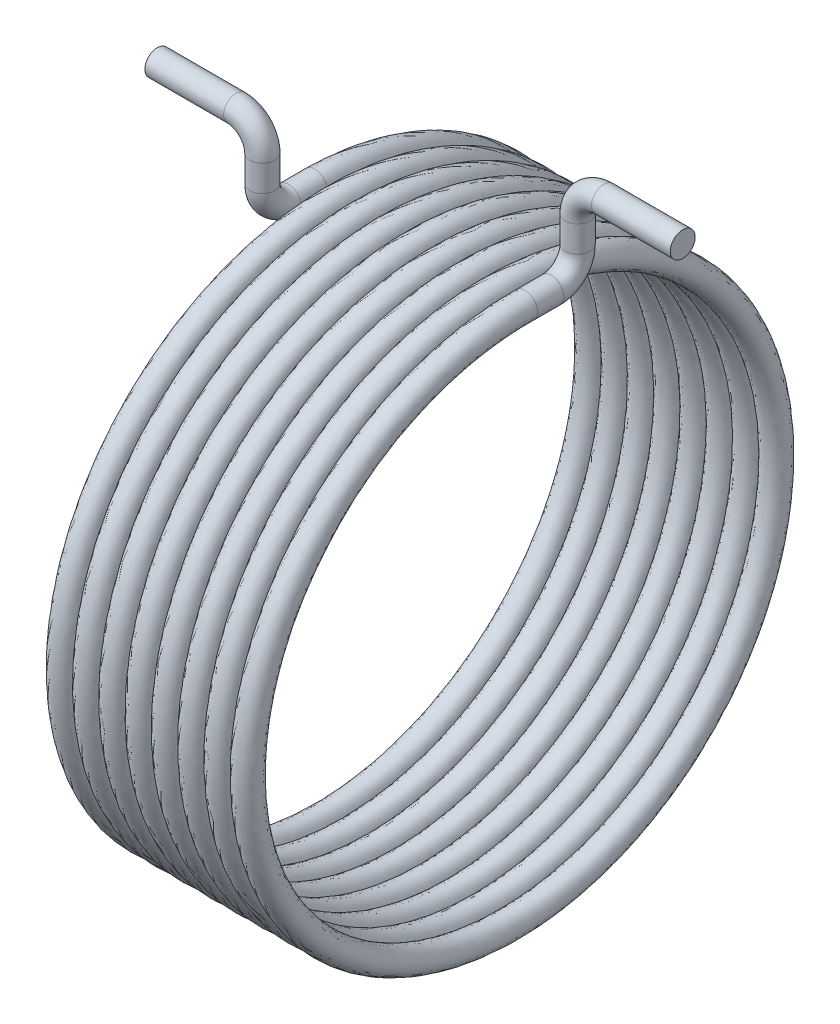
from build123d import *

# Parameters (mm, degrees)
SWEEP1_PITCH       = 1
SWEEP1_HEIGHT      = 8
SWEEP1_RADIUS      = 10.5
SWEEP1_START_ANGLE = -90
SKETCH2_R          = 0.475
SKETCH3_R          = 0.475
SKETCH5_R          = 0.475


with BuildPart() as part:
    # Sweep1: sweep along a helix
    with BuildLine() as sweep1_path:
        add(Helix(SWEEP1_PITCH, SWEEP1_HEIGHT, SWEEP1_RADIUS, center=(-2.5, 0, 0), direction=(1, 0, 0), lefthand=True, mode=Mode.PRIVATE).rotate(Axis((-2.5, 0, 0), (1, 0, 0)), SWEEP1_START_ANGLE))
    # Sketch2 → Sweep1 (sweep)
    with BuildSketch(Plane.XY):
        with Locations((-2.469362338, 10.304578214)):
            Circle(SKETCH2_R)
    sweep(path=sweep1_path.line, is_frenet=True)

    # Sweep4: sweep along a curve in space
    with BuildLine() as sweep4_path:
        Line((-2.469362338, 10.304578214, 0), (-2.469362338, 10.304578214, 1))
        ThreePointArc((-2.469362338, 10.304578214, 1), (-2.469362338, 10.597471432, 1.707106781), (-2.469362338, 11.304578214, 2))
        Line((-2.469362338, 11.304578214, 2), (-2.469362338, 12.304578214, 2))
        ThreePointArc((-2.469362338, 12.304578214, 2), (-2.762255557, 13.011684995, 2), (-3.469362338, 13.304578214, 2))
        Line((-3.469362338, 13.304578214, 2), (-6.469362338, 13.304578214, 2))
    # Sketch3 → Sweep4 (sweep)
    with BuildSketch(Plane.XY):
        with Locations((-2.469362338, 10.304578214)):
            Circle(SKETCH3_R)
    sweep(path=sweep4_path.line)

    # Sweep5: sweep along a curve in space
    with BuildLine() as sweep5_path:
        Line((5.530637662, 10.304578214, 0), (5.530637662, 10.304578214, -1))
        ThreePointArc((5.530637662, 10.304578214, -1), (5.530637662, 10.597471432, -1.707106781), (5.530637662, 11.304578214, -2))
        Line((5.530637662, 11.304578214, -2), (5.530637662, 12.304578214, -2))
        ThreePointArc((5.530637662, 12.304578214, -2), (5.823530881, 13.011684995, -2), (6.530637662, 13.304578214, -2))
        Line((6.530637662, 13.304578214, -2), (9.530637662, 13.304578214, -2))
    # Sketch5 → Sweep5 (sweep)
    with BuildSketch(Plane(origin=(0, 0, 0), x_dir=(-1, 0, 0), z_dir=(0, 0, -1))):
        with Locations((-5.530637662, 10.304578214)):
            Circle(SKETCH5_R)
    sweep(path=sweep5_path.line)


solid = part.part
